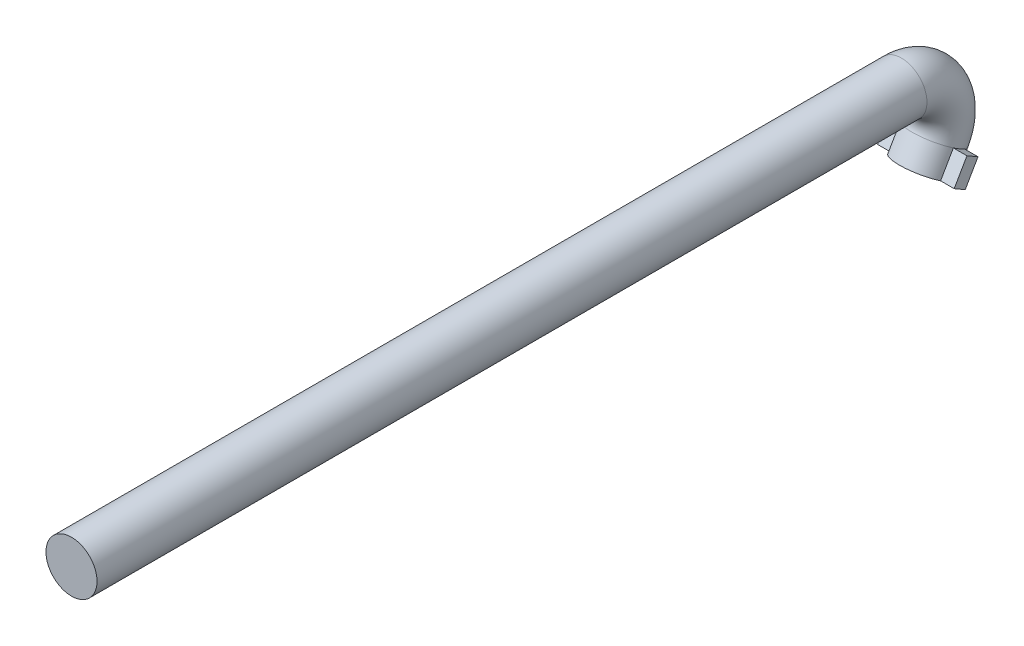
from build123d import *

# Parameters (mm, degrees)
SKETCH1_R           = 2
BOSS_EXTRUDE1_DEPTH = 65
SKETCH8_R           = 2
REVOLVE4_ANGLE      = 120
BOSS_EXTRUDE3_DEPTH = 2


with BuildPart() as part:
    # Sketch1 → Boss-Extrude1 (new body)
    with BuildSketch(Plane.XY):
        Circle(SKETCH1_R)
    extrude(amount=BOSS_EXTRUDE1_DEPTH)

    # Sketch8 → Revolve4 (revolve)
    with BuildSketch(Plane(origin=(0, 0, 0), x_dir=(-1, 0, 0), z_dir=(0, 0, -1))):
        with Locations(Location((0, 0, 0), (0, 0, 90))):
            Circle(SKETCH8_R)
    revolve(axis=Axis((0, -2.964026972, 0), (-1, 0, 0)), revolution_arc=REVOLVE4_ANGLE)

    # Sketch12 → Boss-Extrude3 (add)
    with BuildSketch(Plane(origin=(0, -2.223020229, 1.283461328), x_dir=(1, 0, 0), z_dir=(0, -0.8660254037844362, 0.5000000000000042))):
        with BuildLine():
            Line((2, -4.946040459), (1.936491673, -4.946040459))
            ThreePointArc((1.936491673, -4.946040459), (0, -6.446040459), (-1.936491673, -4.946040459))
            Line((-1.936491673, -4.946040459), (-2, -4.946040459))
            Line((-2, -4.946040459), (-3, -4.946040459))
            Line((-3, -4.946040459), (-3, -3.946040459))
            Line((-3, -3.946040459), (-2, -3.946040459))
            Line((-2, -3.946040459), (-1.936491673, -3.946040459))
            ThreePointArc((-1.936491673, -3.946040459), (0, -2.446040459), (1.936491673, -3.946040459))
            Line((1.936491673, -3.946040459), (2, -3.946040459))
            Line((2, -3.946040459), (3, -3.946040459))
            Line((3, -3.946040459), (3, -4.946040459))
            Line((3, -4.946040459), (2, -4.946040459))
        make_face()
    extrude(amount=BOSS_EXTRUDE3_DEPTH)


solid = part.part
